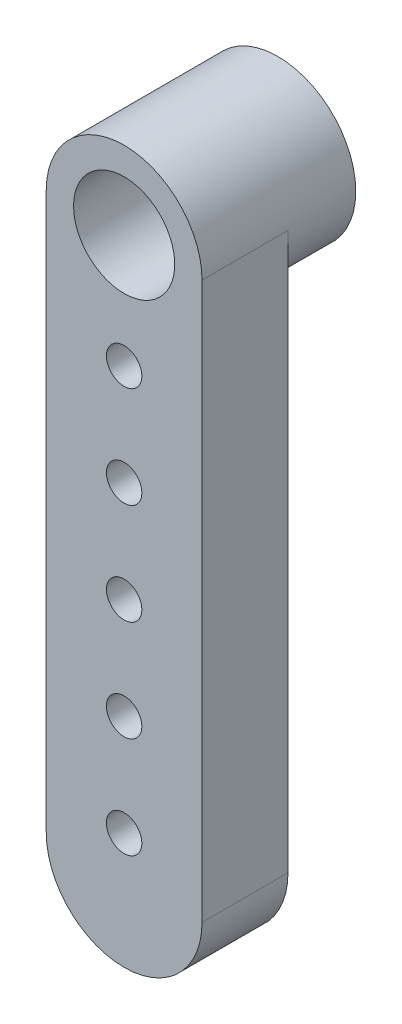
from build123d import *

# Parameters (mm, degrees)
SKETCH1_R           = 0.4445
BOSS_EXTRUDE1_DEPTH = 2.159
SKETCH1_3_R         = 1.9558
BOSS_EXTRUDE2_DEPTH = 3.8608
SKETCH2_R           = 1.27
CUT_EXTRUDE1_DEPTH  = 17.503394679


with BuildPart() as part:
    # Sketch1 → Boss-Extrude1 (new body)
    with BuildSketch(Plane.XY):
        with BuildLine():
            Line((1.9558, -13.97), (1.9558, 0))
            ThreePointArc((1.9558, 0), (0, -1.9558), (-1.9558, 0))
            Line((-1.9558, 0), (-1.9558, -13.97))
            ThreePointArc((-1.9558, -13.97), (0, -15.9258), (1.9558, -13.97))
        make_face()
        with Locations((0, -10.4648)):
            Circle(SKETCH1_R, mode=Mode.SUBTRACT)
        with Locations((0, -7.9248)):
            Circle(SKETCH1_R, mode=Mode.SUBTRACT)
        with Locations((0, -13.0048)):
            Circle(SKETCH1_R, mode=Mode.SUBTRACT)
        with Locations((0, -5.3848)):
            Circle(SKETCH1_R, mode=Mode.SUBTRACT)
        with Locations((0, -2.8448)):
            Circle(SKETCH1_R, mode=Mode.SUBTRACT)
    extrude(amount=-BOSS_EXTRUDE1_DEPTH)

    # Sketch1<3> → Boss-Extrude2 (add)
    with BuildSketch(Plane.XY):
        Circle(SKETCH1_3_R)
    extrude(amount=-BOSS_EXTRUDE2_DEPTH)

    # Sketch2 → Cut-Extrude1 (cut, through all)
    with BuildSketch(Plane(origin=(0, 0, -3.8608), x_dir=(-1, 0, 0), z_dir=(0, 0, -1))):
        Circle(SKETCH2_R)
    extrude(amount=-CUT_EXTRUDE1_DEPTH, mode=Mode.SUBTRACT)


solid = part.part
